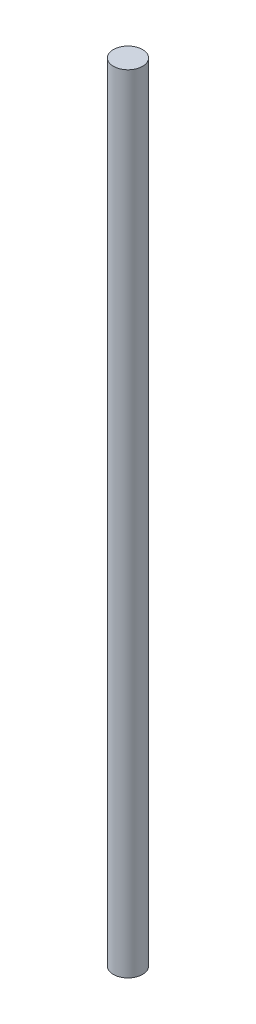
from build123d import *

# Parameters (mm, degrees)
SKETCH_1_R      = 2
EXTRUDE_1_DEPTH = 108


with BuildPart() as part:
    # 草图1 → 凸台-拉伸1 (new body)
    with BuildSketch(Plane(origin=(0, 0, 0), x_dir=(1, 0, 0), z_dir=(0, 1, 0))):
        with Locations(Location((0, 0, 0), (0, 0, 270))):
            Circle(SKETCH_1_R)
    extrude(amount=EXTRUDE_1_DEPTH)


solid = part.part
